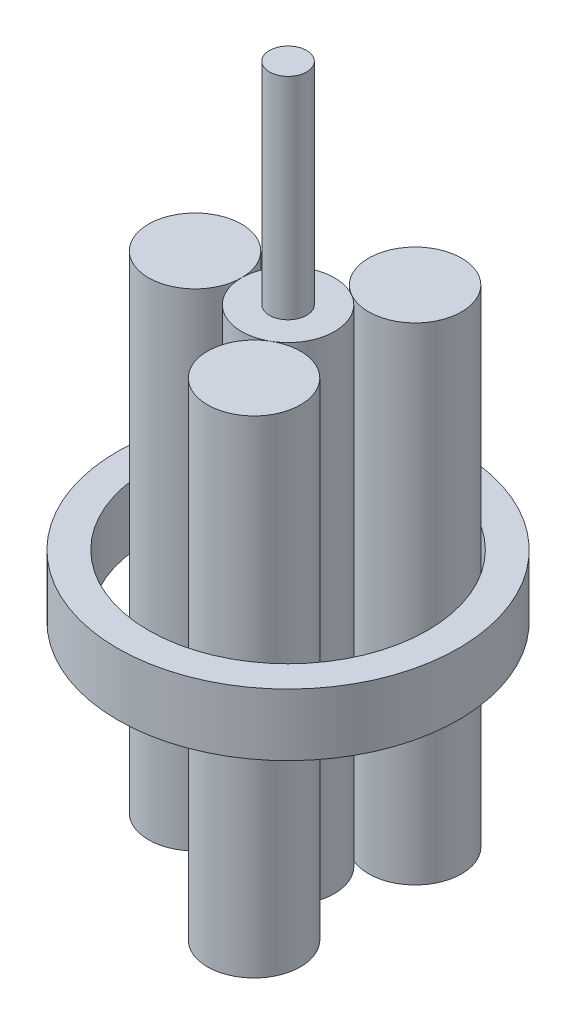
from build123d import *

# Parameters (mm, degrees)
SKETCH1_R             = 1.5
BOSS_EXTRUDE1_DEPTH   = 7.85
BOSS_EXTRUDE1_2_DEPTH = 7.85
BOSS_EXTRUDE1_3_DEPTH = 7.85
BOSS_EXTRUDE1_4_DEPTH = 7.85
SKETCH3_R             = 5.5
SKETCH3_R_2           = 4.5
BOSS_EXTRUDE2_DEPTH   = 1
SKETCH4_R             = 0.6
BOSS_EXTRUDE3_DEPTH   = 6.8


with BuildPart() as part:
    # Sketch1 → Boss-Extrude1 (new, symmetric)
    with BuildSketch(Plane(origin=(0, 0, 0), x_dir=(1, 0, 0), z_dir=(0, 1, 0))):
        with Locations(Location((-3, 0, 0), (0, 0, 270))):
            Circle(SKETCH1_R)
    extrude(amount=BOSS_EXTRUDE1_DEPTH, both=True)


with BuildPart() as body_2:
    # Sketch1 → Boss-Extrude1 2 (new, symmetric)
    with BuildSketch(Plane(origin=(0, 0, 0), x_dir=(1, 0, 0), z_dir=(0, 1, 0))):
        with Locations(Location((0, 0, 0), (0, 0, 270))):
            Circle(SKETCH1_R)
    extrude(amount=BOSS_EXTRUDE1_2_DEPTH, both=True)

    # Sketch4 → Boss-Extrude3 (add)
    with BuildSketch(Plane(origin=(0, 7.85, 0), x_dir=(1, 0, 0), z_dir=(0, 1, 0))):
        with Locations(Location((0, 0, 0), (0, 0, 270))):
            Circle(SKETCH4_R)
    extrude(amount=BOSS_EXTRUDE3_DEPTH)


with BuildPart() as body_3:
    # Sketch1 → Boss-Extrude1 3 (new, symmetric)
    with BuildSketch(Plane(origin=(0, 0, 0), x_dir=(1, 0, 0), z_dir=(0, 1, 0))):
        with Locations(Location((1.5, 2.598076211, 0), (0, 0, 270))):
            Circle(SKETCH1_R)
    extrude(amount=BOSS_EXTRUDE1_3_DEPTH, both=True)


with BuildPart() as body_4:
    # Sketch1 → Boss-Extrude1 4 (new, symmetric)
    with BuildSketch(Plane(origin=(0, 0, 0), x_dir=(1, 0, 0), z_dir=(0, 1, 0))):
        with Locations(Location((1.5, -2.598076211, 0), (0, 0, 270))):
            Circle(SKETCH1_R)
    extrude(amount=BOSS_EXTRUDE1_4_DEPTH, both=True)


with BuildPart() as body_5:
    # Sketch3 → Boss-Extrude2 (new, symmetric)
    with BuildSketch(Plane(origin=(0, 0, 0), x_dir=(1, 0, 0), z_dir=(0, 1, 0))):
        with Locations(Location((0, 0, 0), (0, 0, 270))):
            Circle(SKETCH3_R)
        with Locations(Location((0, 0, 0), (0, 0, 270))):
            Circle(SKETCH3_R_2, mode=Mode.SUBTRACT)
    extrude(amount=BOSS_EXTRUDE2_DEPTH, both=True)


solid = Compound([part.part, body_2.part, body_3.part, body_4.part, body_5.part])
